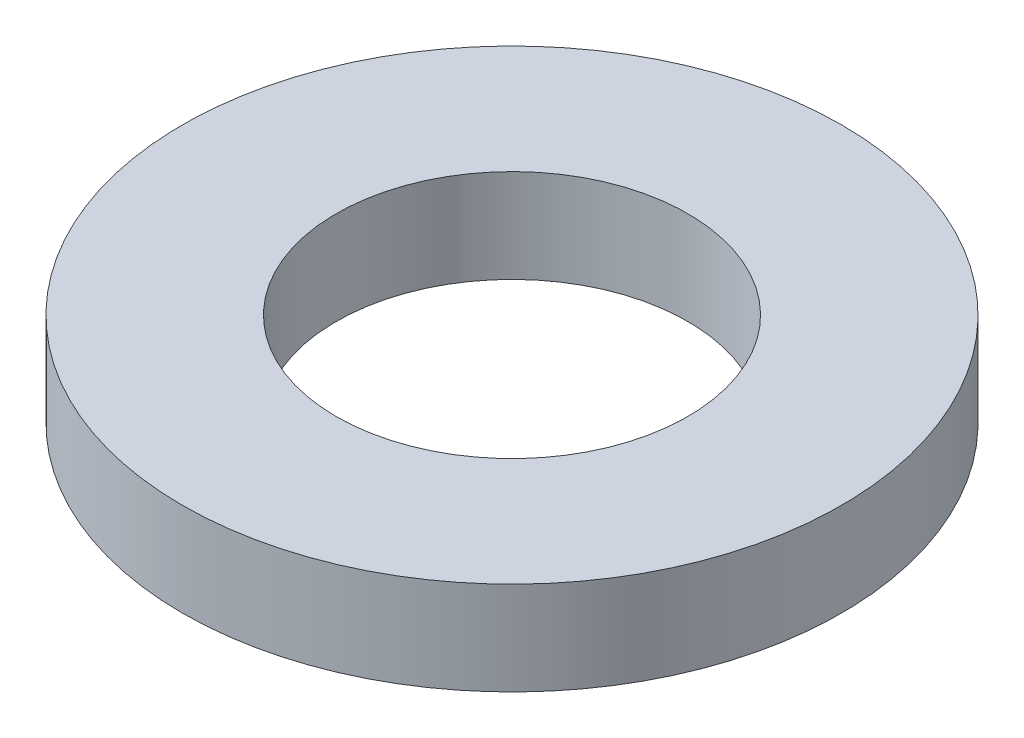
from build123d import *

# Parameters (mm, degrees)
SKETCH1_R           = 6
SKETCH1_R_2         = 3.2
BOSS_EXTRUDE1_DEPTH = 1.7


with BuildPart() as part:
    # Sketch1 → Boss-Extrude1 (new body)
    with BuildSketch(Plane(origin=(0, 0, 0), x_dir=(1, 0, 0), z_dir=(0, 1, 0))):
        with Locations(Location((0, 0, 0), (0, 0, 270))):
            Circle(SKETCH1_R)
        with Locations(Location((0, 0, 0), (0, 0, 270))):
            Circle(SKETCH1_R_2, mode=Mode.SUBTRACT)
    extrude(amount=BOSS_EXTRUDE1_DEPTH)


solid = part.part
